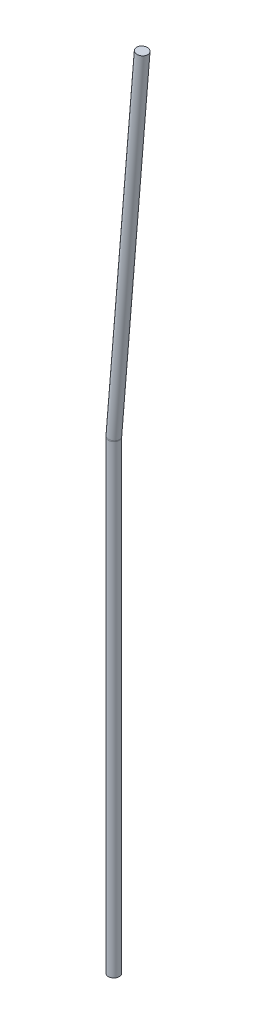
from build123d import *

# Parameters (mm, degrees)
SKETCH1_R           = 0.2
BOSS_EXTRUDE1_DEPTH = 16.65
SKETCH2_R           = 0.2
REVOLVE1_ANGLE      = 4.66
SKETCH3_R           = 0.2
BOSS_EXTRUDE2_DEPTH = 12.5


with BuildPart() as part:
    # Sketch1 → Boss-Extrude1 (new body)
    with BuildSketch(Plane(origin=(0, 0, 0), x_dir=(1, 0, 0), z_dir=(0, 1, 0))):
        with Locations(Location((0, 0, 0), (0, 0, 270))):
            Circle(SKETCH1_R)
    extrude(amount=-BOSS_EXTRUDE1_DEPTH)

    # Sketch2 → Revolve1 (revolve)
    with BuildSketch(Plane(origin=(0, 0, 0), x_dir=(1, 0, 0), z_dir=(0, 1, 0))):
        with Locations(Location((0, 0, 0), (0, 0, 270))):
            Circle(SKETCH2_R)
    revolve(axis=Axis((0.5, 0, -0.2), (0, 0, -1)), revolution_arc=REVOLVE1_ANGLE)

    # Sketch3 → Boss-Extrude2 (add)
    with BuildSketch(Plane(origin=(0.003300189, 0.040487072, 0), x_dir=(0.9966943478093031, -0.08124270456470586, 0), z_dir=(0.08124270456470586, 0.9966943478093031, 0))):
        with Locations(Location((-0.001652826, 0, 0), (0, 0, 180))):
            Circle(SKETCH3_R)
    extrude(amount=BOSS_EXTRUDE2_DEPTH)


solid = part.part
